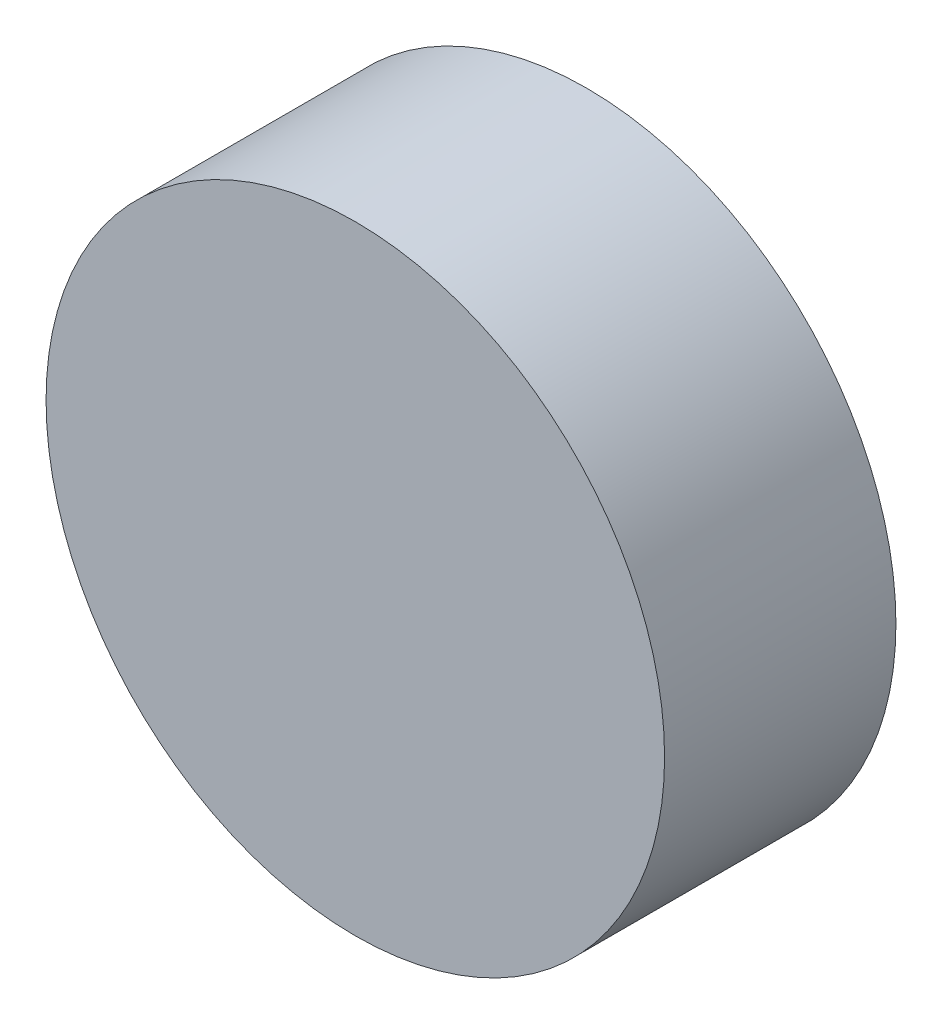
from build123d import *

# Parameters (mm, degrees)
SKETCH1_R           = 6.35
BOSS_EXTRUDE1_DEPTH = 4.7498


with BuildPart() as part:
    # Sketch1 → Boss-Extrude1 (new body)
    with BuildSketch(Plane.XY):
        Circle(SKETCH1_R)
    extrude(amount=BOSS_EXTRUDE1_DEPTH)


solid = part.part
